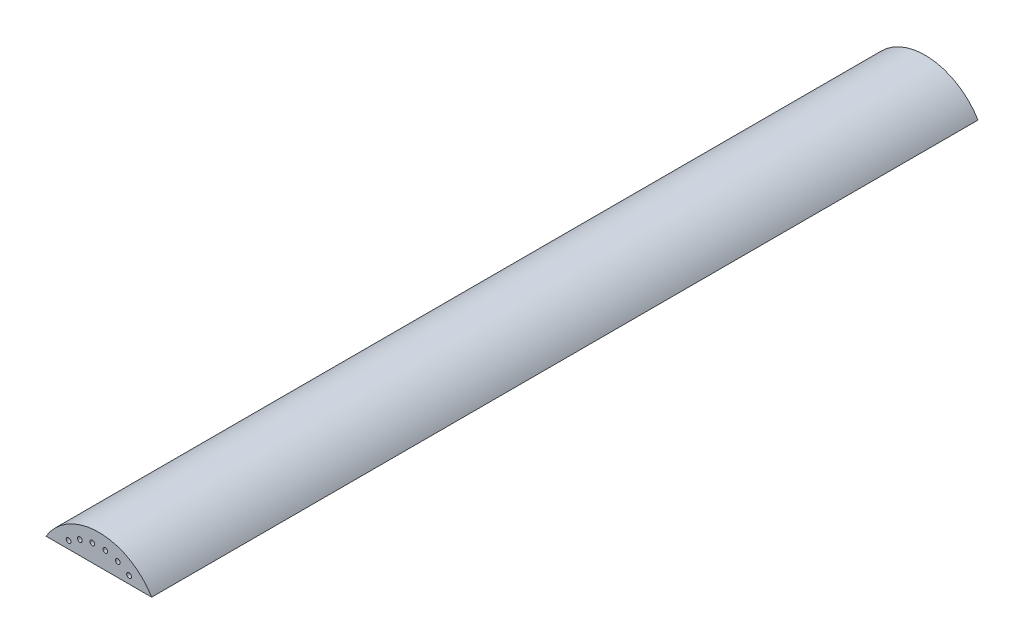
from build123d import *

# Parameters (mm, degrees)
BOSS_EXTRUDE1_DEPTH = 308.00000001
CUT_EXTRUDE1_REACH  = 310.829
SKETCH2_R           = 0.889


with BuildPart() as part:
    # Sketch1 → Boss-Extrude1 (new body)
    with BuildSketch(Plane.XY):
        with BuildLine():
            Line((-19.689777646, 0), (19.689777646, 0))
            ThreePointArc((19.689777646, 0), (0, 11.1125), (-19.689777646, 0))
        make_face()
    extrude(amount=BOSS_EXTRUDE1_DEPTH)

    # Sketch2 → Cut-Extrude1 (cut, up to next)
    with BuildSketch(Plane.XY.offset(308.00000001), mode=Mode.PRIVATE) as cut_extrude1_sk1:
        with Locations((-11.269696042, 2.799461)):
            Circle(SKETCH2_R)
    cut_extrude1_tool1 = extrude(cut_extrude1_sk1.sketch, amount=-CUT_EXTRUDE1_REACH, mode=Mode.PRIVATE) & part.part
    # Sketch2 → Cut-Extrude1 (cut, up to next)
    with BuildSketch(Plane.XY.offset(308.00000001), mode=Mode.PRIVATE) as cut_extrude1_sk2:
        with Locations((-7.084427042, 5.2158138)):
            Circle(SKETCH2_R)
    cut_extrude1_tool2 = extrude(cut_extrude1_sk2.sketch, amount=-CUT_EXTRUDE1_REACH, mode=Mode.PRIVATE) & part.part
    # Sketch2 → Cut-Extrude1 (cut, up to next)
    with BuildSketch(Plane.XY.offset(308.00000001), mode=Mode.PRIVATE) as cut_extrude1_sk3:
        with Locations((-2.416366133, 6.4666114)):
            Circle(SKETCH2_R)
    cut_extrude1_tool3 = extrude(cut_extrude1_sk3.sketch, amount=-CUT_EXTRUDE1_REACH, mode=Mode.PRIVATE) & part.part
    # Sketch2 → Cut-Extrude1 (cut, up to next)
    with BuildSketch(Plane.XY.offset(308.00000001), mode=Mode.PRIVATE) as cut_extrude1_sk4:
        with Locations((2.416366133, 6.4666114)):
            Circle(SKETCH2_R)
    cut_extrude1_tool4 = extrude(cut_extrude1_sk4.sketch, amount=-CUT_EXTRUDE1_REACH, mode=Mode.PRIVATE) & part.part
    # Sketch2 → Cut-Extrude1 (cut, up to next)
    with BuildSketch(Plane.XY.offset(308.00000001), mode=Mode.PRIVATE) as cut_extrude1_sk5:
        with Locations((7.084427042, 5.2158138)):
            Circle(SKETCH2_R)
    cut_extrude1_tool5 = extrude(cut_extrude1_sk5.sketch, amount=-CUT_EXTRUDE1_REACH, mode=Mode.PRIVATE) & part.part
    # Sketch2 → Cut-Extrude1 (cut, up to next)
    with BuildSketch(Plane.XY.offset(308.00000001), mode=Mode.PRIVATE) as cut_extrude1_sk6:
        with Locations((11.269695955, 2.799461)):
            Circle(SKETCH2_R)
    cut_extrude1_tool6 = extrude(cut_extrude1_sk6.sketch, amount=-CUT_EXTRUDE1_REACH, mode=Mode.PRIVATE) & part.part
    add(cut_extrude1_tool1.solids().sort_by_distance((-11.269696, 2.799461, 308))[0], mode=Mode.SUBTRACT)
    add(cut_extrude1_tool2.solids().sort_by_distance((-7.084427, 5.215814, 308))[0], mode=Mode.SUBTRACT)
    add(cut_extrude1_tool3.solids().sort_by_distance((-2.416366, 6.466611, 308))[0], mode=Mode.SUBTRACT)
    add(cut_extrude1_tool4.solids().sort_by_distance((2.416366, 6.466611, 308))[0], mode=Mode.SUBTRACT)
    add(cut_extrude1_tool5.solids().sort_by_distance((7.084427, 5.215814, 308))[0], mode=Mode.SUBTRACT)
    add(cut_extrude1_tool6.solids().sort_by_distance((11.269696, 2.799461, 308))[0], mode=Mode.SUBTRACT)


solid = part.part
